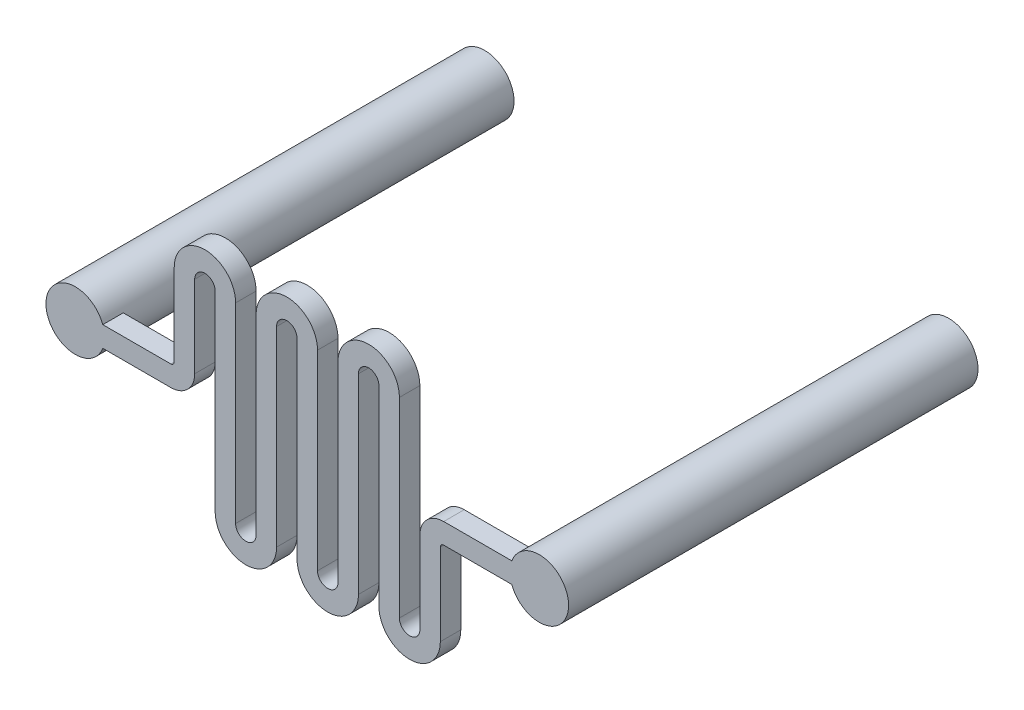
from build123d import *

# Parameters (mm, degrees)
BOSS_EXTRUDE1_DEPTH = 1.5
SKETCH3_W           = 2.15
SKETCH3_H           = 30
SKETCH4_W           = 2.15
SKETCH4_H           = 30
SKETCH5_R           = 1.5
CUT_EXTRUDE1_DEPTH  = 28


with BuildPart() as part:
    # Sketch2 → Boss-Extrude1 (new body)
    with BuildSketch(Plane.XY):
        with BuildLine():
            Line((-20.5, -0.75), (-13.5, -0.75))
            ThreePointArc((-13.5, -0.75), (-12.262563133, -0.237436867), (-11.75, 1))
            Line((-11.75, 1), (-11.75, 7))
            ThreePointArc((-11.75, 7), (-11, 7.75), (-10.25, 7))
            Line((-10.25, 7), (-10.25, 0))
            Line((-10.25, 0), (-10.25, -7))
            ThreePointArc((-10.25, -7), (-8, -9.25), (-5.75, -7))
            Line((-5.75, -7), (-5.75, 0))
            Line((-5.75, 0), (-5.75, 7))
            ThreePointArc((-5.75, 7), (-5, 7.75), (-4.25, 7))
            Line((-4.25, 7), (-4.25, 0))
            Line((-4.25, 0), (-4.25, -7))
            ThreePointArc((-4.25, -7), (-2, -9.25), (0.25, -7))
            Line((0.25, -7), (0.25, 0))
            Line((0.25, 0), (0.25, 7))
            ThreePointArc((0.25, 7), (1, 7.75), (1.75, 7))
            Line((1.75, 7), (1.75, 0))
            Line((1.75, 0), (1.75, -7))
            ThreePointArc((1.75, -7), (4, -9.25), (6.25, -7))
            Line((6.25, -7), (6.25, -1))
            ThreePointArc((6.25, -1), (6.323223305, -0.823223305), (6.5, -0.75))
            Line((6.5, -0.75), (13.5, -0.75))
            ThreePointArc((13.5, -0.75), (14.25, 0), (13.5, 0.75))
            Line((13.5, 0.75), (6.5, 0.75))
            ThreePointArc((6.5, 0.75), (5.262563133, 0.237436867), (4.75, -1))
            Line((4.75, -1), (4.75, -7))
            ThreePointArc((4.75, -7), (4, -7.75), (3.25, -7))
            Line((3.25, -7), (3.25, 0))
            Line((3.25, 0), (3.25, 7))
            ThreePointArc((3.25, 7), (1, 9.25), (-1.25, 7))
            Line((-1.25, 7), (-1.25, 0))
            Line((-1.25, 0), (-1.25, -7))
            ThreePointArc((-1.25, -7), (-2, -7.75), (-2.75, -7))
            Line((-2.75, -7), (-2.75, 0))
            Line((-2.75, 0), (-2.75, 7))
            ThreePointArc((-2.75, 7), (-5, 9.25), (-7.25, 7))
            Line((-7.25, 7), (-7.25, 0))
            Line((-7.25, 0), (-7.25, -7))
            ThreePointArc((-7.25, -7), (-8, -7.75), (-8.75, -7))
            Line((-8.75, -7), (-8.75, 0))
            Line((-8.75, 0), (-8.75, 7))
            ThreePointArc((-8.75, 7), (-11, 9.25), (-13.25, 7))
            Line((-13.25, 7), (-13.25, 1))
            ThreePointArc((-13.25, 1), (-13.323223305, 0.823223305), (-13.5, 0.75))
            Line((-13.5, 0.75), (-20.5, 0.75))
            ThreePointArc((-20.5, 0.75), (-21.25, 0), (-20.5, -0.75))
        make_face()
    extrude(amount=BOSS_EXTRUDE1_DEPTH)

    # Sketch3 → Revolve1 (revolve)
    with BuildSketch(Plane(origin=(0, 0, 0), x_dir=(1, 0, 0), z_dir=(0, 1, 0)), mode=Mode.PRIVATE) as revolve1_sk:
        with Locations((-21.575, 13.5)):
            Rectangle(SKETCH3_W, SKETCH3_H)
    revolve(revolve1_sk.sketch.rotate(Axis((-20.5, 0, 1.5), (0, 0, -1)), 180), axis=Axis((-20.5, 0, 1.5), (0, 0, -1)))

    # Sketch4 → Revolve2 (revolve)
    with BuildSketch(Plane(origin=(0, 0, 0), x_dir=(1, 0, 0), z_dir=(0, 1, 0))):
        with Locations((14.575, 13.5)):
            Rectangle(SKETCH4_W, SKETCH4_H)
    revolve(axis=Axis((13.5, 0, 1.5), (0, 0, -1)))

    # Sketch5 → Cut-Extrude1 (cut)
    with BuildSketch(Plane(origin=(0, 0, -28.5), x_dir=(-1, 0, 0), z_dir=(0, 0, -1))):
        with Locations((20.5, 0)):
            Circle(SKETCH5_R)
        with Locations((-13.5, 0)):
            Circle(SKETCH5_R)
    extrude(amount=-CUT_EXTRUDE1_DEPTH, mode=Mode.SUBTRACT)


solid = part.part
